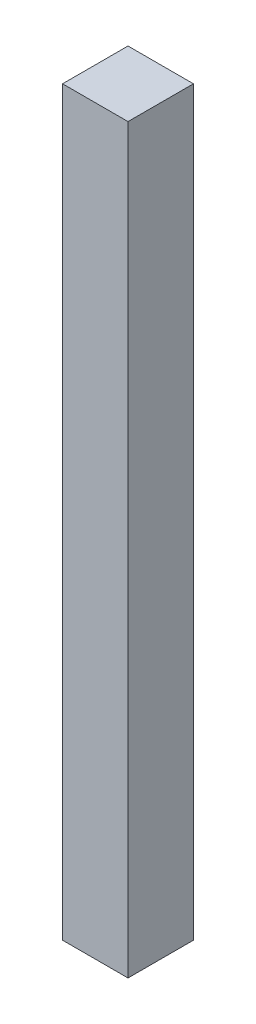
from build123d import *

# Parameters (mm, degrees)
SKETCH_1_W      = 30
SKETCH_1_H      = 30
EXTRUDE_1_DEPTH = 340


with BuildPart() as part:
    # 草图1 → 凸台-拉伸1 (new body)
    with BuildSketch(Plane(origin=(0, 0, 0), x_dir=(1, 0, 0), z_dir=(0, 1, 0))):
        Rectangle(SKETCH_1_W, SKETCH_1_H)
    extrude(amount=EXTRUDE_1_DEPTH)


solid = part.part
